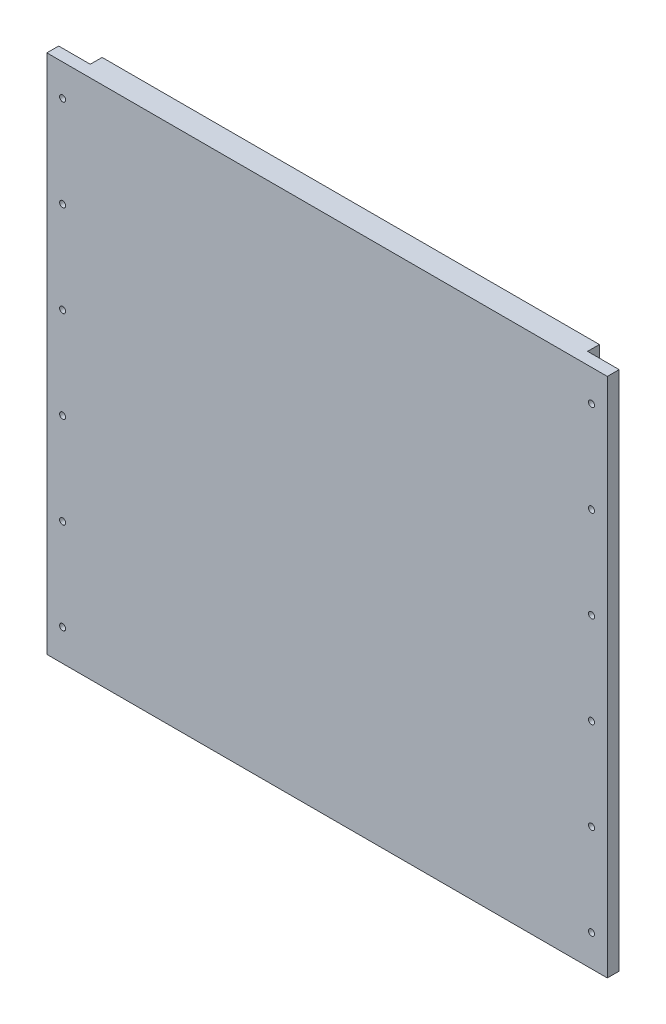
from build123d import *

# Parameters (mm, degrees)
BOSS_EXTRUDE1_DEPTH       = 419.1
F_8_CLEARANCE_HOLE1_D     = 4.9149
F_8_CLEARANCE_HOLE1_DEPTH = 9.652
F_8_CLEARANCE_HOLE1_TIP   = 1.476584928


with BuildPart() as part:
    # Sketch1 → Boss-Extrude1 (new body)
    with BuildSketch(Plane(origin=(0, 0, 0), x_dir=(1, 0, 0), z_dir=(0, 1, 0))):
        Polygon((-17.170187141, 1.020273681), (382.879812859, 1.020273681), (382.879812859, -8.504726319), (408.279812859, -8.504726319), (408.279812859, -18.029726319), (382.879812859, -18.029726319), (-17.170187141, -18.029726319), (-42.570187141, -18.029726319), (-42.570187141, -8.504726319), (-17.170187141, -8.504726319), align=None)
    extrude(amount=BOSS_EXTRUDE1_DEPTH)

    # #8 Clearance Hole1
    with Locations(Plane.XY.offset(18.029726319)):
        with Locations((-29.870187141, 393.7), (-29.870187141, 320.04), (-29.870187141, 246.38), (-29.870187141, 172.72), (-29.870187141, 99.06), (-29.870187141, 25.4), (395.579812859, 25.4), (395.579812859, 99.06), (395.579812859, 172.72), (395.579812859, 246.38), (395.579812859, 320.04), (395.579812859, 393.7)):
            Hole(F_8_CLEARANCE_HOLE1_D / 2, depth=F_8_CLEARANCE_HOLE1_DEPTH)
            with Locations((0, 0, -(F_8_CLEARANCE_HOLE1_DEPTH + F_8_CLEARANCE_HOLE1_TIP / 2))):  # 118° drill point
                Cone(0, F_8_CLEARANCE_HOLE1_D / 2, F_8_CLEARANCE_HOLE1_TIP, mode=Mode.SUBTRACT)


solid = part.part
